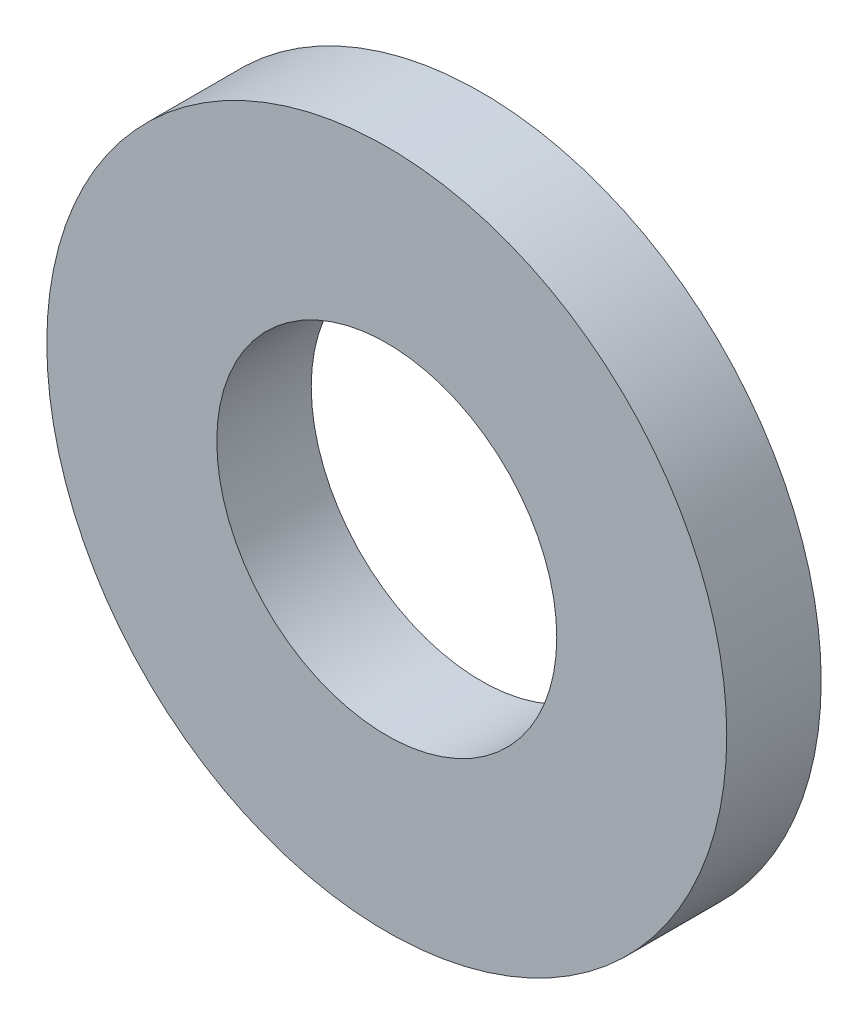
from build123d import *

# Parameters (mm, degrees)
SKETCH1_R           = 9
SKETCH1_R_2         = 4.5
BOSS_EXTRUDE1_DEPTH = 1.25


with BuildPart() as part:
    # Sketch1 → Boss-Extrude1 (new, symmetric)
    with BuildSketch(Plane.XY):
        Circle(SKETCH1_R)
        Circle(SKETCH1_R_2, mode=Mode.SUBTRACT)
    extrude(amount=BOSS_EXTRUDE1_DEPTH, both=True)


solid = part.part
